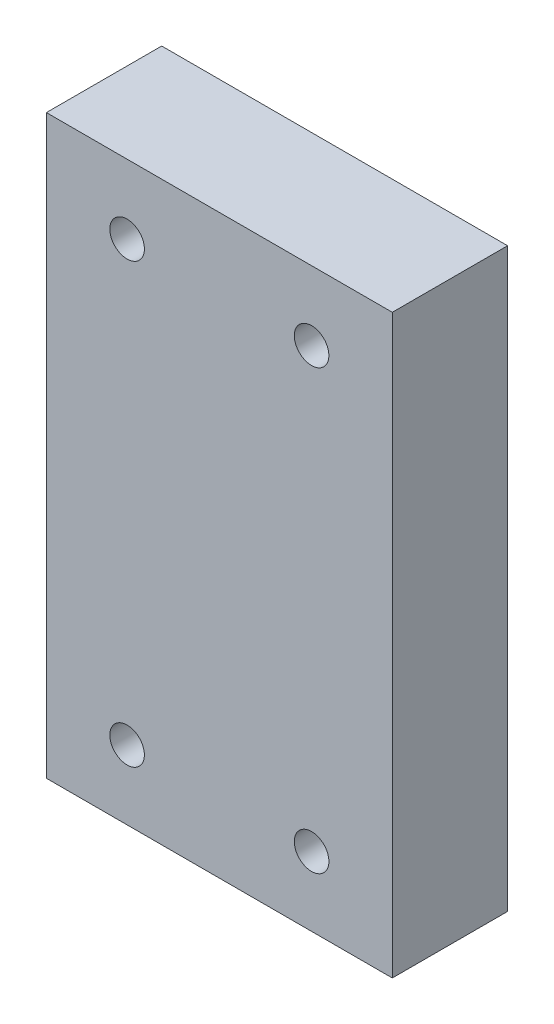
from build123d import *

# Parameters (mm, degrees)
SKETCH1_W           = 30
SKETCH1_H           = 50
SKETCH1_R           = 1.5
BOSS_EXTRUDE1_DEPTH = 10
SKETCH3_R           = 2
CUT_EXTRUDE1_DEPTH  = 10


with BuildPart() as part:
    # Sketch1 → Boss-Extrude1 (new body)
    with BuildSketch(Plane.XY):
        Rectangle(SKETCH1_W, SKETCH1_H)
        with Locations((-8, 19)):
            Circle(SKETCH1_R, mode=Mode.SUBTRACT)
        with Locations(Location((8, 19, 0), (0, 0, 180))):
            Circle(SKETCH1_R, mode=Mode.SUBTRACT)
        with Locations((8, -19)):
            Circle(SKETCH1_R, mode=Mode.SUBTRACT)
        with Locations(Location((-8, -19, 0), (0, 0, 180))):
            Circle(SKETCH1_R, mode=Mode.SUBTRACT)
    extrude(amount=BOSS_EXTRUDE1_DEPTH)

    # Sketch3 → Cut-Extrude1 (cut)
    with BuildSketch(Plane.ZY.offset(15)):
        with Locations(Location((5, 12.5, 0), (0, 0, 270))):
            Circle(SKETCH3_R)
        with Locations(Location((5, -12.5, 0), (0, 0, 90))):
            Circle(SKETCH3_R)
    extrude(amount=-CUT_EXTRUDE1_DEPTH, mode=Mode.SUBTRACT)


solid = part.part
